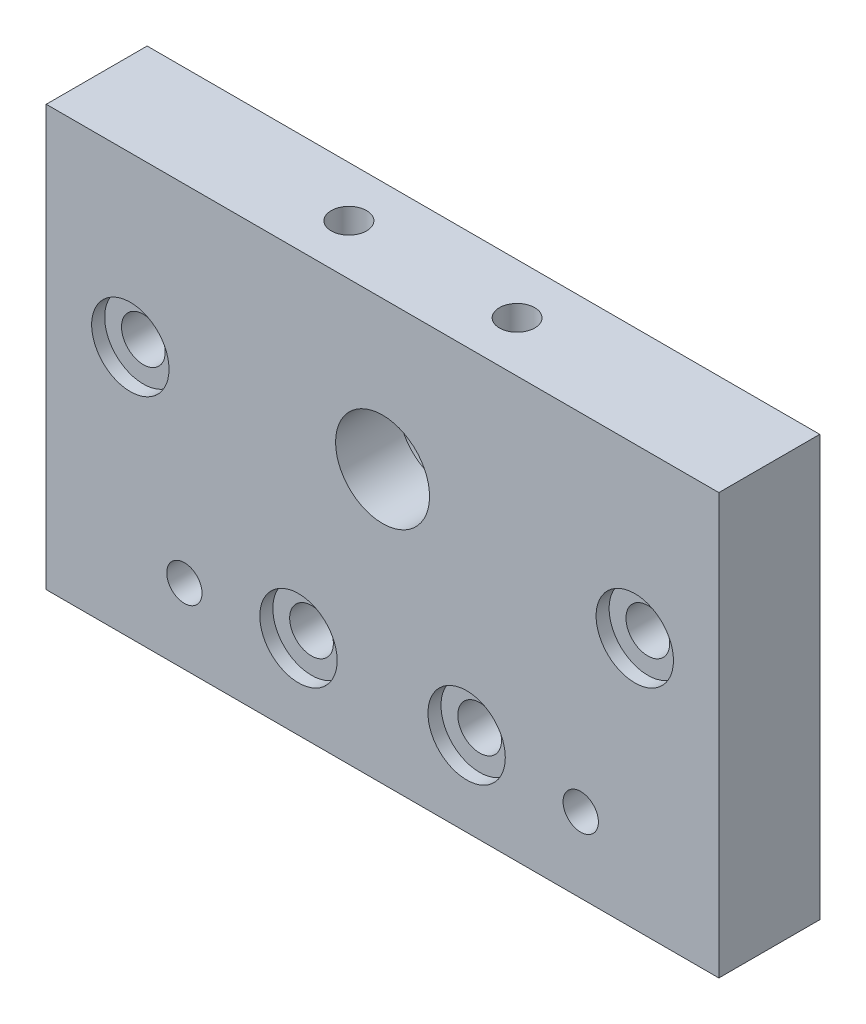
from build123d import *

# Parameters (mm, degrees)
SKETCH1_W                 = 80
SKETCH1_H                 = 50
SKETCH1_R                 = 5.588
SKETCH1_R_2               = 2.6
BOSS_EXTRUDE1_DEPTH       = 12
SKETCH2_R                 = 4.6
CUT_EXTRUDE1_DEPTH        = 1.55
M5X0_8_TAPPED_HOLE1_D     = 4.2
M5X0_8_TAPPED_HOLE2_D     = 4.2
M5X0_8_TAPPED_HOLE2_DEPTH = 14
M5X0_8_TAPPED_HOLE2_TIP   = 1.2618073
SKETCH7_R                 = 8.05
CUT_EXTRUDE2_DEPTH        = 4.5


with BuildPart() as part:
    # Sketch1 → Boss-Extrude1 (new body)
    with BuildSketch(Plane.XY):
        with Locations((40, 25)):
            Rectangle(SKETCH1_W, SKETCH1_H)
        with Locations((40, 32.4)):
            Circle(SKETCH1_R, mode=Mode.SUBTRACT)
        with Locations((30, 10)):
            Circle(SKETCH1_R_2, mode=Mode.SUBTRACT)
        with Locations((10, 30)):
            Circle(SKETCH1_R_2, mode=Mode.SUBTRACT)
        with Locations(Location((50, 10, 0), (0, 0, 180))):
            Circle(SKETCH1_R_2, mode=Mode.SUBTRACT)
        with Locations(Location((70, 30, 0), (0, 0, 180))):
            Circle(SKETCH1_R_2, mode=Mode.SUBTRACT)
    extrude(amount=BOSS_EXTRUDE1_DEPTH)

    # Sketch2 → Cut-Extrude1 (cut)
    with BuildSketch(Plane.XY.offset(12)):
        with Locations((10, 30)):
            Circle(SKETCH2_R)
        with Locations((30, 10)):
            Circle(SKETCH2_R)
        with Locations((50, 10)):
            Circle(SKETCH2_R)
        with Locations((70, 30)):
            Circle(SKETCH2_R)
    extrude(amount=-CUT_EXTRUDE1_DEPTH, mode=Mode.SUBTRACT)

    # M5x0.8 Tapped Hole1 (through all)
    with Locations(Plane.XY.offset(12)):
        with Locations((16.43, 8.9), (63.57, 8.9)):
            Hole(M5X0_8_TAPPED_HOLE1_D / 2)

    # M5x0.8 Tapped Hole2
    with Locations(Plane(origin=(0, 50, 0), x_dir=(1, 0, 0), z_dir=(0, 1, 0))):
        with Locations((30, -6), (50, -6)):
            Hole(M5X0_8_TAPPED_HOLE2_D / 2, depth=M5X0_8_TAPPED_HOLE2_DEPTH)
            with Locations((0, 0, -(M5X0_8_TAPPED_HOLE2_DEPTH + M5X0_8_TAPPED_HOLE2_TIP / 2))):  # 118° drill point
                Cone(0, M5X0_8_TAPPED_HOLE2_D / 2, M5X0_8_TAPPED_HOLE2_TIP, mode=Mode.SUBTRACT)

    # Sketch7 → Cut-Extrude2 (cut)
    with BuildSketch(Plane(origin=(0, 0, 0), x_dir=(-1, 0, 0), z_dir=(0, 0, -1))):
        with Locations((-40, 32.4)):
            Circle(SKETCH7_R)
    extrude(amount=-CUT_EXTRUDE2_DEPTH, mode=Mode.SUBTRACT)


solid = part.part
